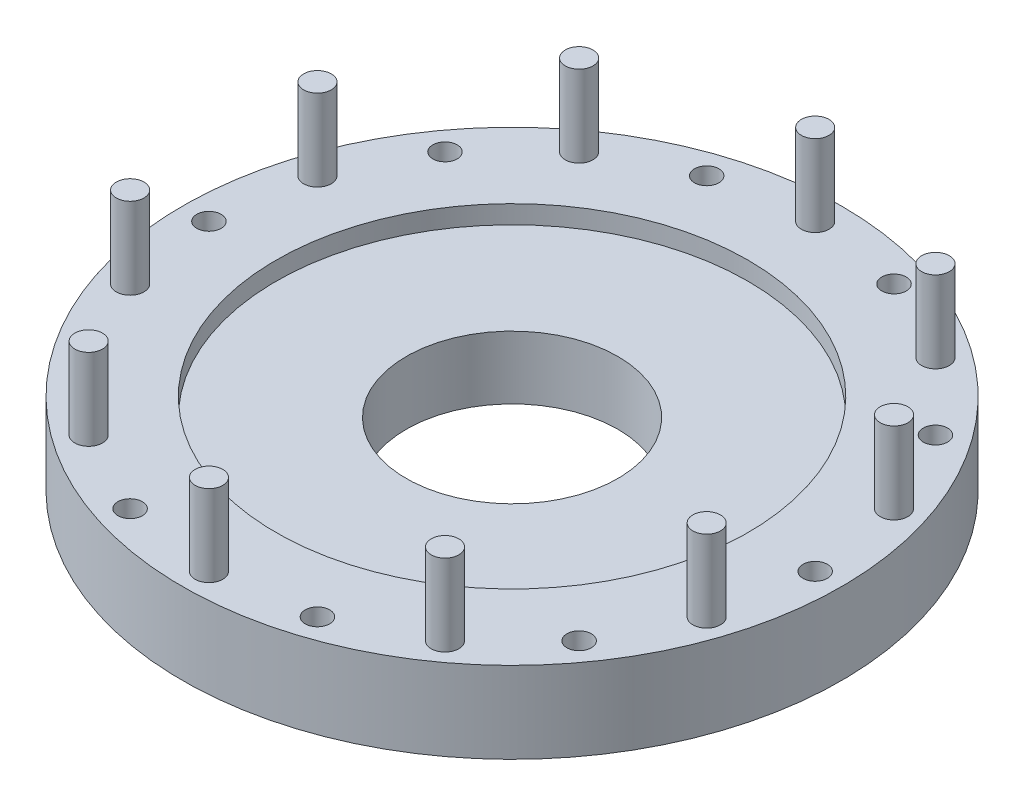
from build123d import *

# Parameters (mm, degrees)
CUT_EXTRUDE1_DEPTH      = 59.142067387
CUT_EXTRUDE1_DEPTH_BACK = 59.142067387
SKETCH2_R               = 1.7
SKETCH2_R_2             = 1.5
SKETCH3_W               = 7
SKETCH3_H               = 4
CUT_EXTRUDE2_DEPTH      = 5
BOSS_EXTRUDE1_START     = -20
SKETCH5_R               = 1.7
BOSS_EXTRUDE1_DEPTH     = 20


with BuildPart() as part:
    # Sketch1 → Revolve1 (revolve)
    with BuildSketch(Plane.XY, mode=Mode.PRIVATE) as revolve1_sk:
        Polygon((-29, 10), (-40.5, 10), (-40.5, 0), (-13, 0), (-13, 7.75), (-29, 7.75), align=None)
    revolve(revolve1_sk.sketch.rotate(Axis((0, -1.751877994, 0), (0, 1, 0)), 270), axis=Axis((0, -1.751877994, 0), (0, 1, 0)))

    # Sketch2 → Cut-Extrude1 (cut, two sides: drawn at the far end of the back side and taken through both)
    with BuildSketch(Plane(origin=(0, 10, 0), x_dir=(1, 0, 0), z_dir=(0, 1, 0)).offset(-CUT_EXTRUDE1_DEPTH_BACK)):
        with Locations(Location((0, 37.25, 0), (0, 0, 270))):
            Circle(SKETCH2_R)
        with Locations(Location((11.51088304, 35.426855232, 0), (0, 0, 270))):
            Circle(SKETCH2_R_2)
        with Locations(Location((21.895000648, 30.13588304, 0), (0, 0, 270))):
            Circle(SKETCH2_R)
        with Locations(Location((30.13588304, 21.895000648, 0), (0, 0, 270))):
            Circle(SKETCH2_R_2)
        with Locations(Location((35.426855232, 11.51088304, 0), (0, 0, 270))):
            Circle(SKETCH2_R)
        with Locations(Location((37.25, 0, 0), (0, 0, 270))):
            Circle(SKETCH2_R_2)
        with Locations(Location((35.426855232, -11.51088304, 0), (0, 0, 270))):
            Circle(SKETCH2_R)
        with Locations(Location((30.13588304, -21.895000648, 0), (0, 0, 270))):
            Circle(SKETCH2_R_2)
        with Locations(Location((21.895000648, -30.13588304, 0), (0, 0, 270))):
            Circle(SKETCH2_R)
        with Locations(Location((11.51088304, -35.426855232, 0), (0, 0, 270))):
            Circle(SKETCH2_R_2)
        with Locations(Location((0, -37.25, 0), (0, 0, 270))):
            Circle(SKETCH2_R)
        with Locations(Location((-11.51088304, -35.426855232, 0), (0, 0, 270))):
            Circle(SKETCH2_R_2)
        with Locations(Location((-21.895000648, -30.13588304, 0), (0, 0, 270))):
            Circle(SKETCH2_R)
        with Locations(Location((-30.13588304, -21.895000648, 0), (0, 0, 270))):
            Circle(SKETCH2_R_2)
        with Locations(Location((-35.426855232, -11.51088304, 0), (0, 0, 270))):
            Circle(SKETCH2_R)
        with Locations(Location((-37.25, 0, 0), (0, 0, 270))):
            Circle(SKETCH2_R_2)
        with Locations(Location((-35.426855232, 11.51088304, 0), (0, 0, 270))):
            Circle(SKETCH2_R)
        with Locations(Location((-30.13588304, 21.895000648, 0), (0, 0, 270))):
            Circle(SKETCH2_R_2)
        with Locations(Location((-21.895000648, 30.13588304, 0), (0, 0, 270))):
            Circle(SKETCH2_R)
        with Locations(Location((-11.51088304, 35.426855232, 0), (0, 0, 270))):
            Circle(SKETCH2_R_2)
    extrude(amount=CUT_EXTRUDE1_DEPTH + CUT_EXTRUDE1_DEPTH_BACK, mode=Mode.SUBTRACT)

    # Sketch3 → Cut-Revolve1 (revolve, cut)
    with BuildSketch(Plane.XY, mode=Mode.PRIVATE) as cut_revolve1_sk:
        with Locations((25, 2)):
            Rectangle(SKETCH3_W, SKETCH3_H)
    revolve(cut_revolve1_sk.sketch.rotate(Axis((0, -19.065406541, 0), (0, 1, 0)), 90), axis=Axis((0, -19.065406541, 0), (0, 1, 0)), mode=Mode.SUBTRACT)

    # Sketch4 → Cut-Extrude2 (cut)
    with BuildSketch(Plane.XZ):
        Polygon((10.850674752, 38.532891025), (8.490872994, 36.408115979), (9.151081283, 33.302080186), (12.171091329, 32.320819439), (14.530893087, 34.445594485), (13.870684798, 37.551630278), align=None)
        Polygon((33.293914202, 22.226923098), (31.427445347, 24.795897085), (28.269414185, 24.463974635), (26.977851878, 21.563078198), (28.844320733, 18.994104211), (32.002351895, 19.326026661), align=None)
        Polygon((40, -1.58771324), (40, 1.58771324), (37.25, 3.175426481), (34.5, 1.58771324), (34.5, -1.58771324), (37.25, -3.175426481), align=None)
        Polygon((31.427445347, -24.795897085), (33.293914202, -22.226923098), (32.002351895, -19.326026661), (28.844320733, -18.994104211), (26.977851878, -21.563078198), (28.269414185, -24.463974635), align=None)
        Polygon((10.850674752, -38.532891025), (13.870684798, -37.551630278), (14.530893087, -34.445594485), (12.171091329, -32.320819439), (9.151081283, -33.302080186), (8.490872994, -36.408115979), align=None)
        Polygon((-13.870684798, -37.551630278), (-10.850674752, -38.532891025), (-8.490872994, -36.408115979), (-9.151081283, -33.302080186), (-12.171091329, -32.320819439), (-14.530893087, -34.445594485), align=None)
        Polygon((-33.293914202, -22.226923098), (-31.427445347, -24.795897085), (-28.269414185, -24.463974635), (-26.977851878, -21.563078198), (-28.844320733, -18.994104211), (-32.002351895, -19.326026661), align=None)
        Polygon((-40, 1.58771324), (-40, -1.58771324), (-37.25, -3.175426481), (-34.5, -1.58771324), (-34.5, 1.58771324), (-37.25, 3.175426481), align=None)
        Polygon((-31.427445347, 24.795897085), (-33.293914202, 22.226923098), (-32.002351895, 19.326026661), (-28.844320733, 18.994104211), (-26.977851878, 21.563078198), (-28.269414185, 24.463974635), align=None)
        Polygon((-10.850674752, 38.532891025), (-13.870684798, 37.551630278), (-14.530893087, 34.445594485), (-12.171091329, 32.320819439), (-9.151081283, 33.302080186), (-8.490872994, 36.408115979), align=None)
    extrude(amount=-CUT_EXTRUDE2_DEPTH, mode=Mode.SUBTRACT)

    # Sketch5 → Boss-Extrude1 (add)
    with BuildSketch(Plane.XZ.offset(BOSS_EXTRUDE1_START)):
        with Locations(Location((21.895000648, 30.13588304, 0), (0, 0, 270))):
            Circle(SKETCH5_R)
        with Locations(Location((35.426855232, 11.51088304, 0), (0, 0, 270))):
            Circle(SKETCH5_R)
        with Locations(Location((35.426855232, -11.51088304, 0), (0, 0, 270))):
            Circle(SKETCH5_R)
        with Locations(Location((21.895000648, -30.13588304, 0), (0, 0, 270))):
            Circle(SKETCH5_R)
        with Locations(Location((0, -37.25, 0), (0, 0, 270))):
            Circle(SKETCH5_R)
        with Locations(Location((-35.426855232, 11.51088304, 0), (0, 0, 270))):
            Circle(SKETCH5_R)
        with Locations(Location((-21.895000648, 30.13588304, 0), (0, 0, 270))):
            Circle(SKETCH5_R)
        with Locations(Location((0, 37.25, 0), (0, 0, 270))):
            Circle(SKETCH5_R)
        with Locations(Location((-21.895000648, -30.13588304, 0), (0, 0, 270))):
            Circle(SKETCH5_R)
        with Locations(Location((-35.426855232, -11.51088304, 0), (0, 0, 270))):
            Circle(SKETCH5_R)
    extrude(amount=BOSS_EXTRUDE1_DEPTH)


solid = part.part
